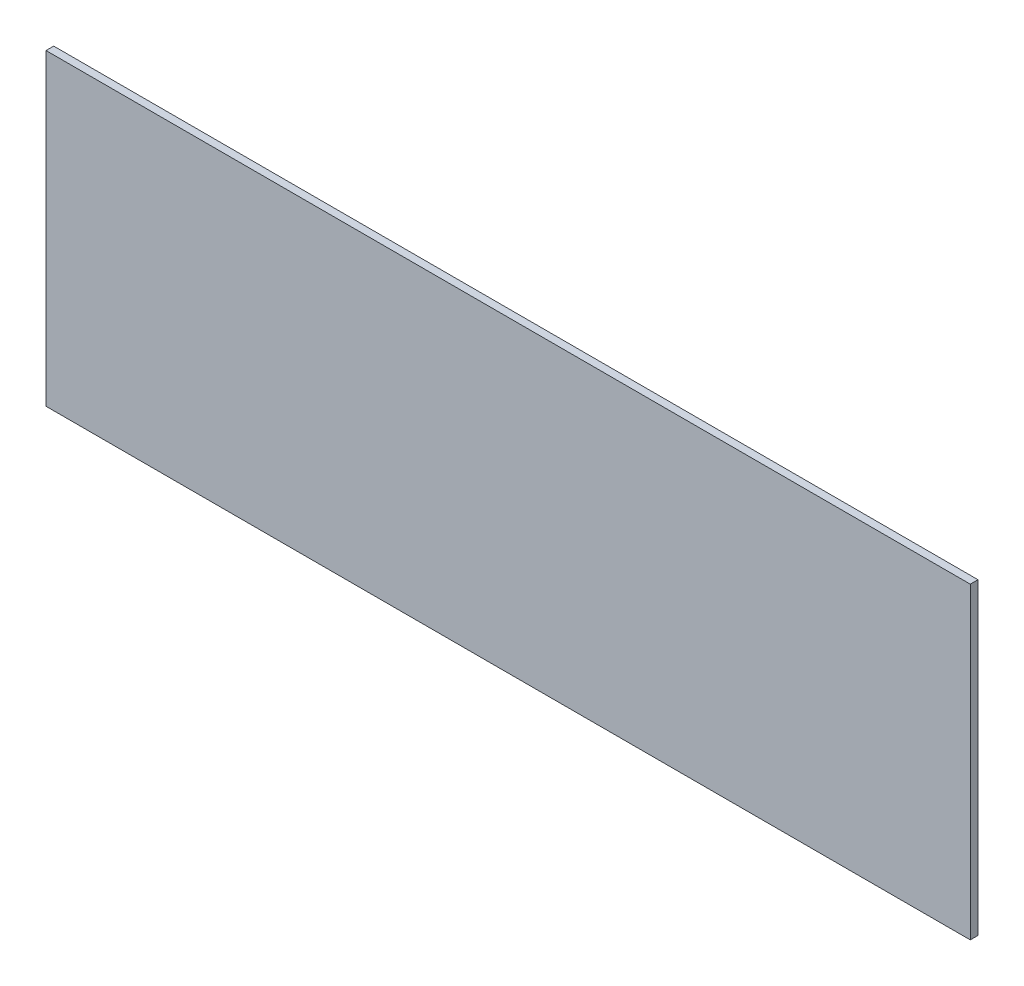
from build123d import *

# Parameters (mm, degrees)
SKETCH_1_W      = 12000
SKETCH_1_H      = 4000
EXTRUDE_1_DEPTH = 100


with BuildPart() as part:
    # 草图1 → 凸台-拉伸1 (new body)
    with BuildSketch(Plane.XY):
        Rectangle(SKETCH_1_W, SKETCH_1_H)
    extrude(amount=EXTRUDE_1_DEPTH)


solid = part.part
